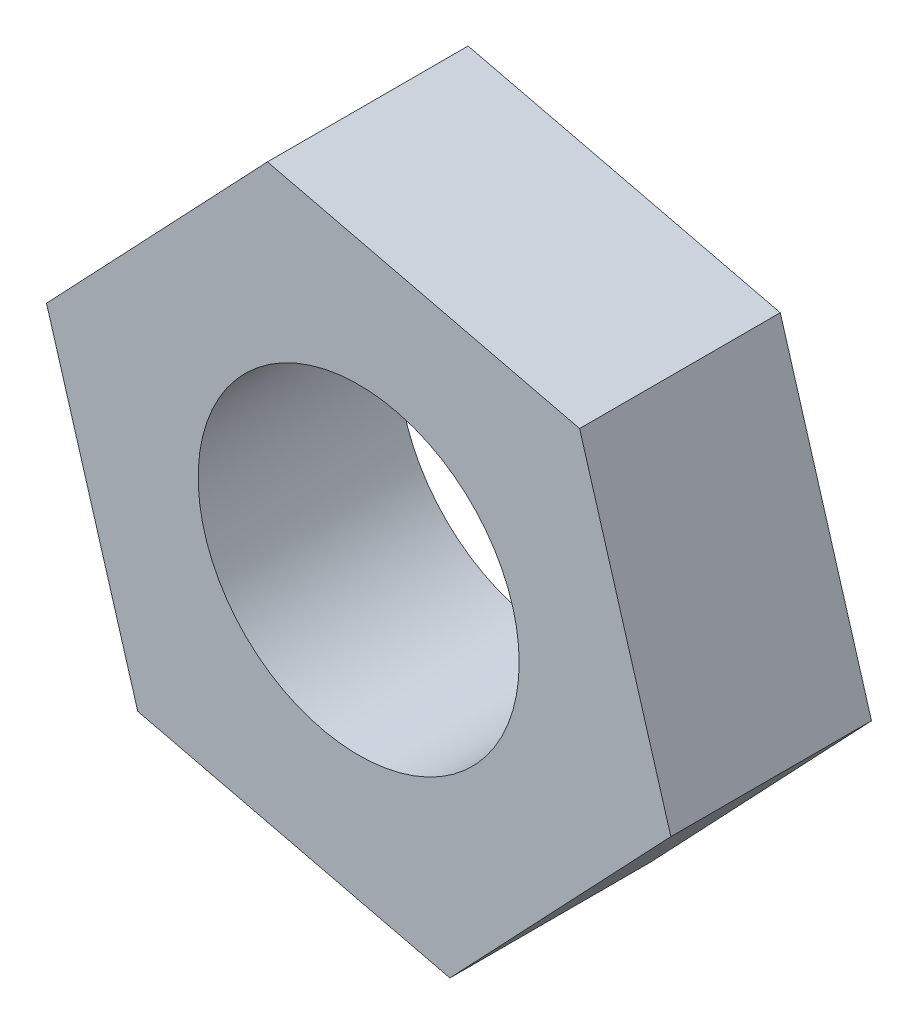
from build123d import *

# Parameters (mm, degrees)
EXTRUDE_1_DEPTH     = 5
SKETCH_2_R          = 4
CUT_EXTRUDE_1_DEPTH = 13.014515077


with BuildPart() as part:
    # 草图1 → 凸台-拉伸1 (new body)
    with BuildSketch(Plane.XY):
        Polygon((5.505745716, 5.804029989), (-2.273564557, 7.670130651), (-7.779310273, 1.866100662), (-5.505745716, -5.804029989), (2.273564557, -7.670130651), (7.779310273, -1.866100662), align=None)
    extrude(amount=EXTRUDE_1_DEPTH)

    # 草图2 → 切除-拉伸1 (cut, through all)
    with BuildSketch(Plane.XY.offset(5)):
        Circle(SKETCH_2_R)
    extrude(amount=-CUT_EXTRUDE_1_DEPTH, mode=Mode.SUBTRACT)


solid = part.part
